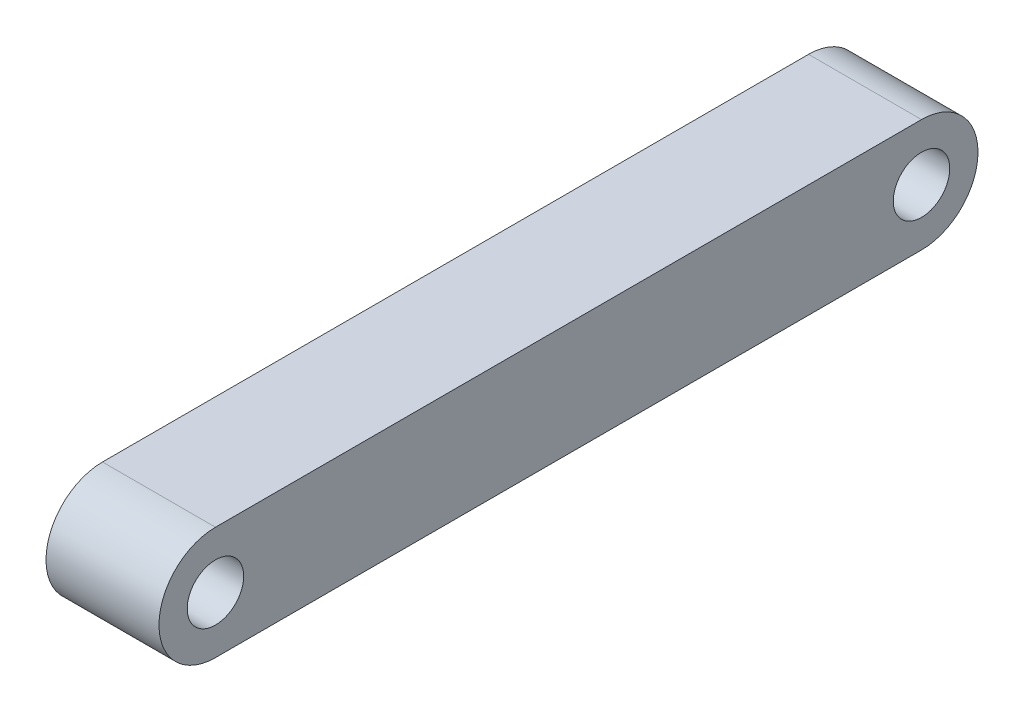
from build123d import *
from build123d.topology import SkipClean

# Parameters (mm, degrees)
BOSS_EXTRUDE1_DEPTH = 20


with BuildPart() as part:
    # Sketch1 → Boss-Extrude1 (new, symmetric)
    with SkipClean():  # the faces are left unmerged after this step: merging them gives an invalid solid
        with BuildSketch(Plane(origin=(0, 0, 0), x_dir=(0, 0, -1), z_dir=(1, 0, 0))):
            with BuildLine():
                ThreePointArc((0, 20), (-20, 0), (0, -20))
                Line((0, -20), (0, -10))
                ThreePointArc((0, -10), (-10, 0), (0, 10))
                Line((0, 10), (0, 20))
            make_face()
            with BuildLine():
                Line((0, -10), (0, -20))
                ThreePointArc((0, -20), (14.142135624, -14.142135624), (20, 0))
                ThreePointArc((20, 0), (14.142135624, 14.142135624), (0, 20))
                Line((0, 20), (0, 10))
                ThreePointArc((0, 10), (7.071067812, 7.071067812), (10, 0))
                ThreePointArc((10, 0), (7.071067812, -7.071067812), (0, -10))
            make_face()
            with BuildLine():
                ThreePointArc((20, 0), (14.142135624, -14.142135624), (0, -20))
                Line((0, -20), (250, -20))
                ThreePointArc((250, -20), (230, 0), (250, 20))
                Line((250, 20), (0, 20))
                ThreePointArc((0, 20), (14.142135624, 14.142135624), (20, 0))
            make_face()
            with BuildLine():
                ThreePointArc((250, 20), (230, 0), (250, -20))
                Line((250, -20), (250, -10))
                ThreePointArc((250, -10), (240, 0), (250, 10))
                Line((250, 10), (250, 20))
            make_face()
            with BuildLine():
                Line((250, -10), (250, -20))
                ThreePointArc((250, -20), (264.142135624, -14.142135624), (270, 0))
                ThreePointArc((270, 0), (264.142135624, 14.142135624), (250, 20))
                Line((250, 20), (250, 10))
                ThreePointArc((250, 10), (257.071067812, 7.071067812), (260, 0))
                ThreePointArc((260, 0), (257.071067812, -7.071067812), (250, -10))
            make_face()
        extrude(amount=BOSS_EXTRUDE1_DEPTH, both=True)


solid = part.part
